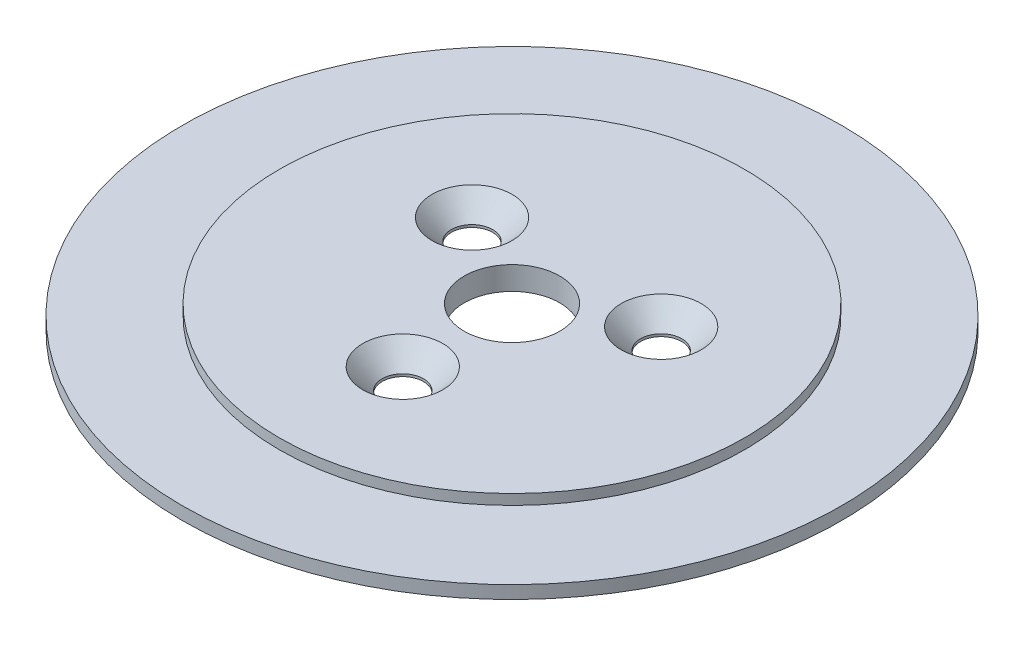
from build123d import *

# Parameters (mm, degrees)
SKETCH1_R           = 25.5
SKETCH1_R_2         = 3.7
BOSS_EXTRUDE1_DEPTH = 1
SKETCH1_3_R         = 18
SKETCH1_3_R_2       = 3.7
BOSS_EXTRUDE2_DEPTH = 1.8
HOLE1_D             = 3.2
HOLE1_DEPTH         = 7.857098765
HOLE1_CSINK_D       = 6.2
HOLE1_CSINK_ANGLE   = 86


with BuildPart() as part:
    # Sketch1 → Boss-Extrude1 (new body)
    with BuildSketch(Plane(origin=(0, 0, 0), x_dir=(1, 0, 0), z_dir=(0, 1, 0))):
        Circle(SKETCH1_R)
        Circle(SKETCH1_R_2, mode=Mode.SUBTRACT)
    extrude(amount=BOSS_EXTRUDE1_DEPTH)

    # Sketch1<3> → Boss-Extrude2 (add)
    with BuildSketch(Plane(origin=(0, 0, 0), x_dir=(1, 0, 0), z_dir=(0, 1, 0))):
        Circle(SKETCH1_3_R)
        Circle(SKETCH1_3_R_2, mode=Mode.SUBTRACT)
    extrude(amount=BOSS_EXTRUDE2_DEPTH)

    # Hole1
    with Locations(Plane(origin=(7.317914662, 1.8, -4.225), x_dir=(0, 0, 1), z_dir=(0, 1, 0))):
        with Locations((0, 0), (0, -14.635829324), (12.675, -7.317914662)):
            CounterSinkHole(HOLE1_D / 2, HOLE1_CSINK_D / 2, depth=HOLE1_DEPTH, counter_sink_angle=HOLE1_CSINK_ANGLE)


solid = part.part
